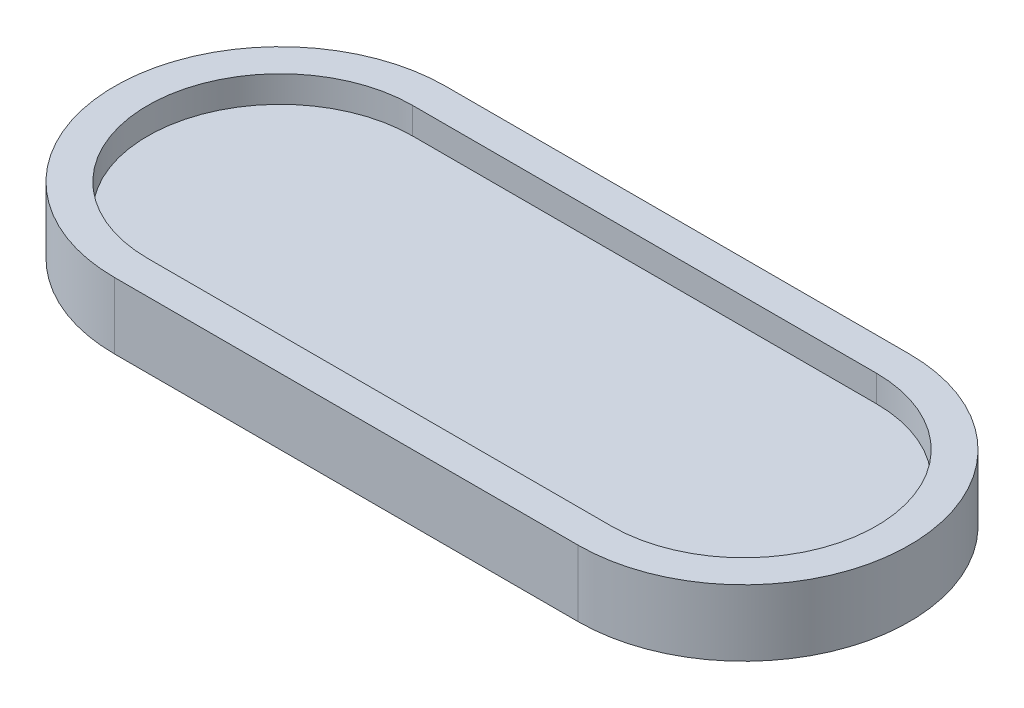
from build123d import *

# Parameters (mm, degrees)
EXTRUDE_1_DEPTH     = 5
CUT_EXTRUDE_1_DEPTH = 2


with BuildPart() as part:
    # 草圖1 → 填料-伸長1 (new body)
    with BuildSketch(Plane(origin=(0, 0, 0), x_dir=(1, 0, 0), z_dir=(0, 1, 0))):
        with BuildLine():
            Line((0, 12.5), (35, 12.5))
            ThreePointArc((35, 12.5), (47.5, 0), (35, -12.5))
            Line((35, -12.5), (0, -12.5))
            ThreePointArc((0, -12.5), (-12.5, 0), (0, 12.5))
        make_face()
    extrude(amount=EXTRUDE_1_DEPTH)

    # 草圖2 → 除料-伸長1 (cut)
    with BuildSketch(Plane(origin=(0, 5, 0), x_dir=(1, 0, 0), z_dir=(0, 1, 0))):
        with BuildLine():
            Line((0, -10), (35, -10))
            ThreePointArc((35, -10), (45, 0), (35, 10))
            Line((35, 10), (0, 10))
            ThreePointArc((0, 10), (-10, 0), (0, -10))
        make_face()
    extrude(amount=-CUT_EXTRUDE_1_DEPTH, mode=Mode.SUBTRACT)


solid = part.part
